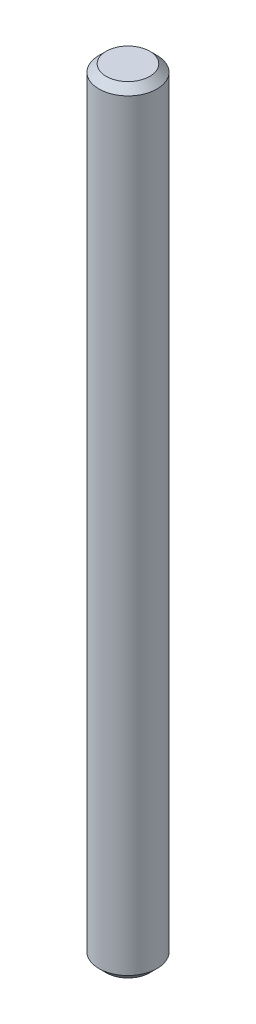
from build123d import *


with BuildPart() as part:
    # Sketch1 → Revolve1 (revolve)
    with BuildSketch(Plane.XY, mode=Mode.PRIVATE) as revolve1_sk:
        Polygon((0, 26.7), (1.5, 26.7), (2, 26.2), (2, -26.2), (1.5, -26.7), (0, -26.7), align=None)
    revolve(revolve1_sk.sketch.rotate(Axis((0, -26.7, 0), (0, 1, 0)), 270), axis=Axis((0, -26.7, 0), (0, 1, 0)))


solid = part.part
